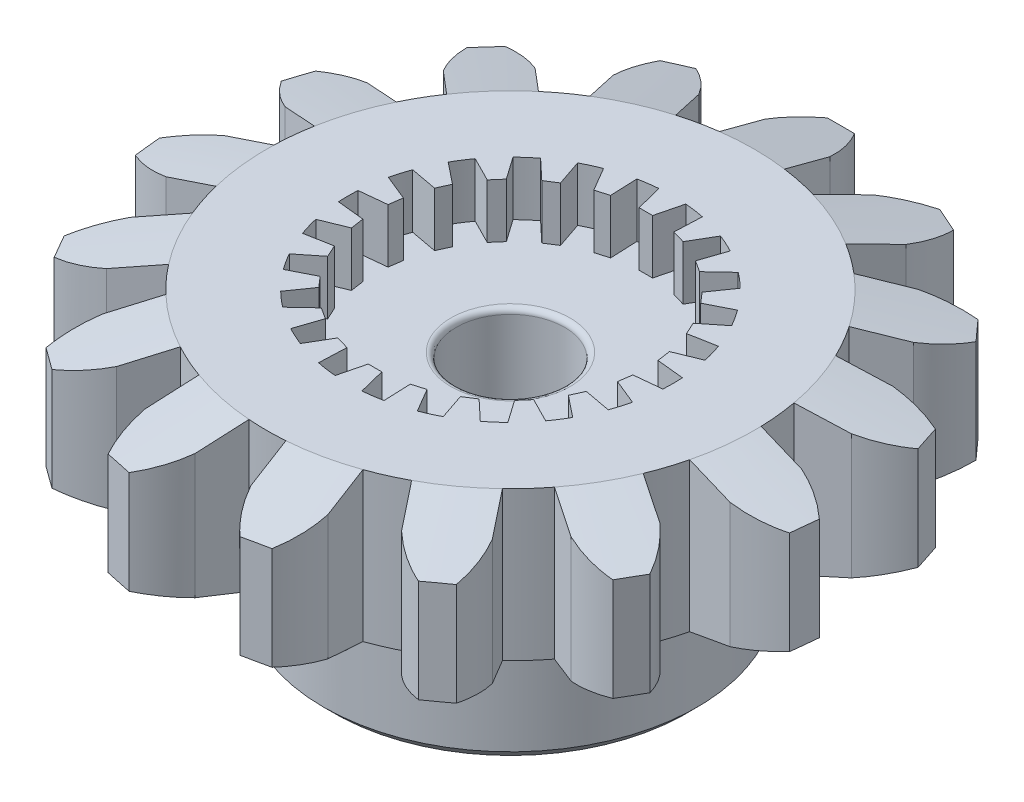
from build123d import *

# Parameters (mm, degrees)
SKETCH_1_R               = 9
EXTRUDE_1_DEPTH          = 5.5
SKETCH_2_R               = 6
CUT_EXTRUDE_1_DEPTH      = 2
EXTRUDE_START            = -5.5
EXTRUDE_2_DEPTH          = 5.5
PATTERN_CIRCULAR_1_COUNT = 15
EXTRUDE_3_DEPTH          = 2
PATTERN_CIRCULAR_2_COUNT = 22
SKETCH_5_R               = 6.9
EXTRUDE_4_DEPTH          = 4.8
CUT_EXTRUDE_2_DEPTH      = 5
FILLET_1_R               = 0.2
CUT_EXTRUDE_3_REACH      = 22.085
SKETCH_7_R               = 2
CHAMFER_1_SIZE           = 0.4
CHAMFER_2_SIZE           = 0.4
FILLET_2_R               = 0.2
CUT_EXTRUDE_4_REACH      = 20.099
CUT_EXTRUDE_4_END_RADIUS = 6.9
SKETCH_10_R              = 1.2


with BuildPart() as part:
    # 草图1 → 凸台-拉伸1 (new body)
    with BuildSketch(Plane(origin=(0, 0, 0), x_dir=(1, 0, 0), z_dir=(0, 1, 0))):
        with Locations(Location((0, 0, 0), (0, 0, 270))):
            Circle(SKETCH_1_R)
    extrude(amount=EXTRUDE_1_DEPTH)

    # 草图2 → 切除-拉伸1 (cut)
    with BuildSketch(Plane(origin=(0, 5.5, 0), x_dir=(1, 0, 0), z_dir=(0, 1, 0))):
        with Locations(Location((0, 0, 0), (0, 0, 270))):
            Circle(SKETCH_2_R)
    extrude(amount=-CUT_EXTRUDE_1_DEPTH, mode=Mode.SUBTRACT)

    # 草图3 → 凸台-拉伸2 (add)
    with BuildSketch(Plane(origin=(0, 5.5, 0), x_dir=(1, 0, 0), z_dir=(0, 1, 0)).offset(EXTRUDE_START)):
        with BuildLine():
            Line((0.5, 12.2), (-0.5, 12.2))
            ThreePointArc((-0.5, 12.2), (-0.936477567, 11.437833935), (-1.2, 10.6))
            Line((-1.2, 10.6), (-1.2, 8.919641248))
            ThreePointArc((-1.2, 8.919641248), (0, 9), (1.2, 8.919641248))
            Line((1.2, 8.919641248), (1.2, 10.6))
            ThreePointArc((1.2, 10.6), (0.936477567, 11.437833935), (0.5, 12.2))
        make_face()
    extrude_2 = extrude(amount=EXTRUDE_2_DEPTH)

    # 阵列(圆周)1: 凸台-拉伸2 ×15 about axis
    pattern_circular_1_axis = Axis((0, 0, 0), (0, 1, 0))
    for i in range(1, PATTERN_CIRCULAR_1_COUNT):
        add(extrude_2.rotate(pattern_circular_1_axis, i * 360 / PATTERN_CIRCULAR_1_COUNT))

    # 草图4 → 凸台-拉伸3 (add)
    with BuildSketch(Plane(origin=(0, 5.5, 0), x_dir=(1, 0, 0), z_dir=(0, 1, 0))):
        with BuildLine():
            Line((0.25, 5), (-0.25, 5))
            Line((-0.25, 5), (-0.494888896, 5.979555584))
            ThreePointArc((-0.494888896, 5.979555584), (0, 6), (0.494888896, 5.979555584))
            Line((0.494888896, 5.979555584), (0.25, 5))
        make_face()
    extrude_3 = extrude(amount=-EXTRUDE_3_DEPTH)

    # 阵列(圆周)2: 凸台-拉伸3 ×22 about axis
    pattern_circular_2_axis = Axis((0, 0, 0), (0, 1, 0))
    for i in range(1, PATTERN_CIRCULAR_2_COUNT):
        add(extrude_3.rotate(pattern_circular_2_axis, i * 360 / PATTERN_CIRCULAR_2_COUNT))

    # 草图5 → 凸台-拉伸4 (add)
    with BuildSketch(Plane.XZ):
        with Locations(Location((0, 0, 0), (0, 0, 90))):
            Circle(SKETCH_5_R)
    extrude(amount=EXTRUDE_4_DEPTH)

    # 草图6 → 切除-拉伸2 (cut)
    with BuildSketch(Plane(origin=(0, -4.8, 0), x_dir=(-1, 0, 0), z_dir=(0, -1, 0))):
        with BuildLine():
            Line((3, -4.369210455), (3, 4.369210455))
            ThreePointArc((3, 4.369210455), (5.3, 0), (3, -4.369210455))
        make_face()
        with BuildLine():
            Line((-3, -4.369210455), (-3, 4.369210455))
            ThreePointArc((-3, 4.369210455), (-5.3, 0), (-3, -4.369210455))
        make_face()
    extrude(amount=-CUT_EXTRUDE_2_DEPTH, mode=Mode.SUBTRACT)

    # 圆角1
    fillet_1_edges = [part.edges().sort_by_distance(p)[0] for p in [
        (-3, -2.3, -4.369210455),
        (-3, -2.3, 4.369210455),
        (3, -2.3, 4.369210455),
        (3, -2.3, -4.369210455),
    ]]
    fillet(fillet_1_edges, radius=FILLET_1_R)

    # 草图7 → 切除-拉伸3 (cut, up to next)
    with BuildSketch(Plane.XZ.offset(4.8), mode=Mode.PRIVATE) as cut_extrude_3_sk1:
        with Locations(Location((0, 0, 0), (0, 0, 270))):
            Circle(SKETCH_7_R)
    cut_extrude_3_tool1 = extrude(cut_extrude_3_sk1.sketch, amount=-CUT_EXTRUDE_3_REACH, mode=Mode.PRIVATE) & part.part
    add(cut_extrude_3_tool1.solids().sort_by_distance((0, -4.8, 0))[0], mode=Mode.SUBTRACT)

    # 倒角1
    chamfer_1_edges = [part.edges().sort_by_distance(p)[0] for p in [
        (3, -4.8, 0),
        (5.3, -4.8, 0),
        (-3, -4.8, 0),
        (-5.3, -4.8, 0),
        (3.113680938, -4.8, 4.151559399),
        (3.113680938, -4.8, -4.151559399),
        (-3.113680938, -4.8, -4.151559399),
        (-3.113680938, -4.8, 4.151559399),
        (0, -4.8, 2),
    ]]
    chamfer(chamfer_1_edges, length=CHAMFER_1_SIZE)

    # 倒角2
    chamfer_2_edges = [part.edges().sort_by_distance(p)[0] for p in [
        (0, -4.8, -6.9),
    ]]
    chamfer(chamfer_2_edges, length=CHAMFER_2_SIZE)

    # 圆角2
    fillet_2_edges = [part.edges().sort_by_distance(p)[0] for p in [
        (0, 3.5, 2),
    ]]
    fillet(fillet_2_edges, radius=FILLET_2_R)

    # 草图9 → 切除-旋转2 (revolve, cut)
    with BuildSketch(Plane(origin=(0, 0, 0), x_dir=(0, 0, -1), z_dir=(1, 0, 0))):
        Polygon((14, 5.5), (9, 5.5), (14, 4.171875), align=None)
        Polygon((14, 1.328125), (14, 0), (9, 0), align=None)
    revolve(axis=Axis((0, 0, 0), (0, 1, 0)), mode=Mode.SUBTRACT)

    # 切除-拉伸4: up to this cylinder (the profile starts inside it)
    cut_extrude_4_end = Plane(origin=(0, -1.3, 0), z_dir=(0, 1, 0)) * Cylinder(CUT_EXTRUDE_4_END_RADIUS, 54.998, mode=Mode.PRIVATE)
    # 草图10 → 切除-拉伸4 (cut, up to the surface)
    with BuildSketch(Plane.XY, mode=Mode.PRIVATE) as cut_extrude_4_sk1:
        with Locations(Location((0, -1.3, 0), (0, 0, 180))):
            Circle(SKETCH_10_R)
    cut_extrude_4_tool1 = extrude(cut_extrude_4_sk1.sketch, amount=CUT_EXTRUDE_4_REACH, mode=Mode.PRIVATE) & cut_extrude_4_end
    add(cut_extrude_4_tool1.solids().sort_by_distance((0, -1.3, 0))[0], mode=Mode.SUBTRACT)


solid = part.part
